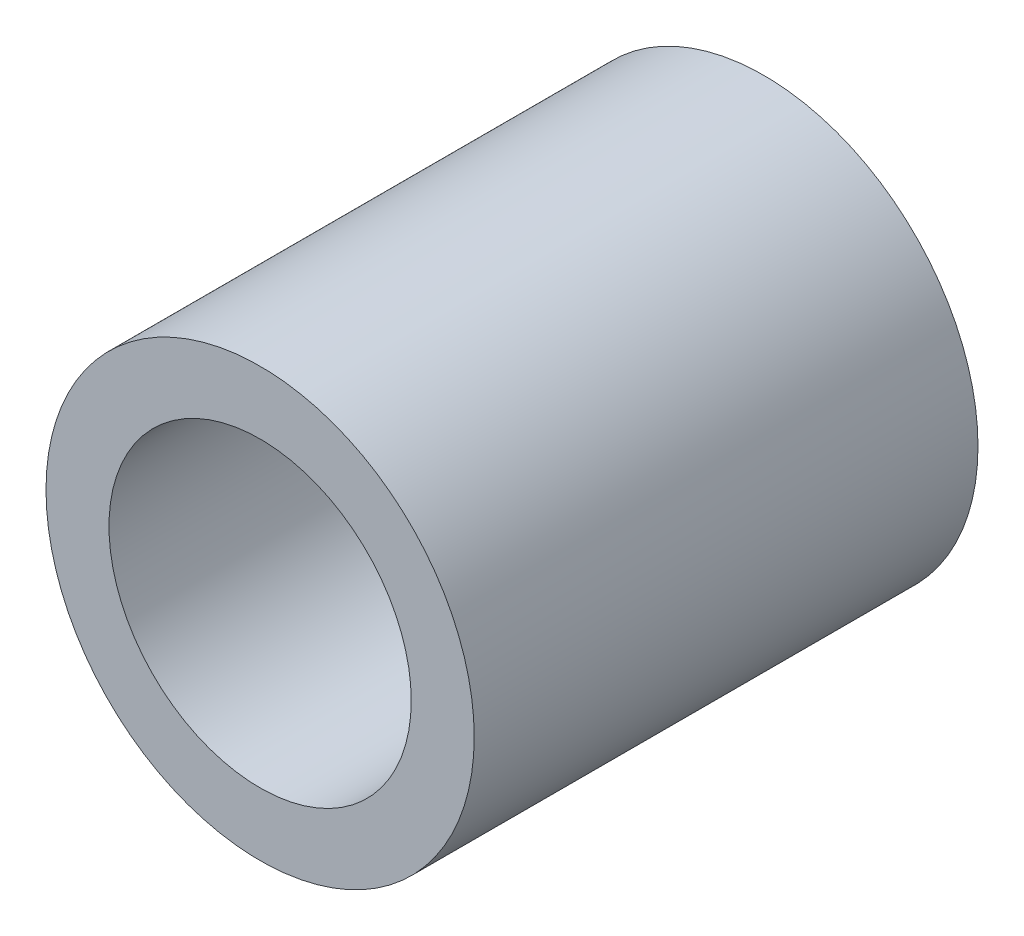
from build123d import *

# Parameters (mm, degrees)
SKETCH1_R           = 10.795
SKETCH1_R_2         = 7.62
BOSS_EXTRUDE1_DEPTH = 25.4


with BuildPart() as part:
    # Sketch1 → Boss-Extrude1 (new body)
    with BuildSketch(Plane(origin=(0, 0, 0), x_dir=(0, 1, 0), z_dir=(0, 0, 1))):
        with Locations(Location((0, 0, 0), (0, 0, 270))):
            Circle(SKETCH1_R)
        with Locations(Location((0, 0, 0), (0, 0, 270))):
            Circle(SKETCH1_R_2, mode=Mode.SUBTRACT)
    extrude(amount=BOSS_EXTRUDE1_DEPTH)


solid = part.part
